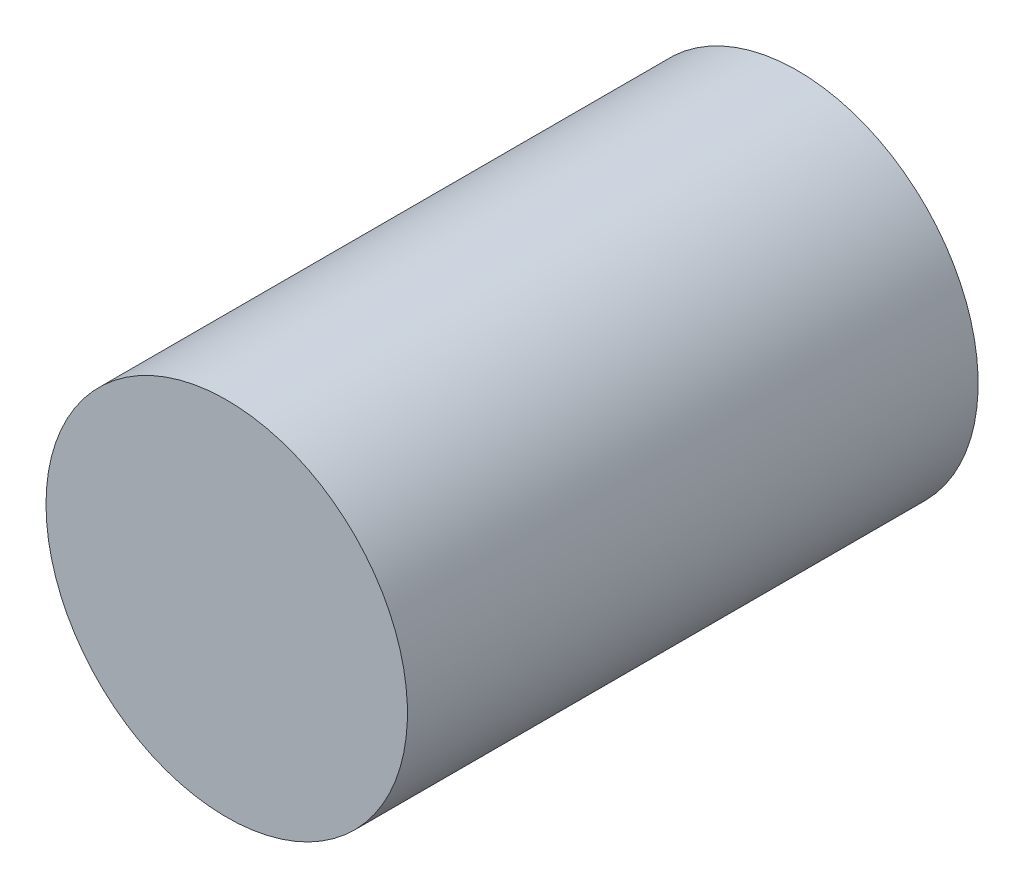
from build123d import *

# Parameters (mm, degrees)
SKETCH1_R           = 12.065
BOSS_EXTRUDE1_DEPTH = 38.1


with BuildPart() as part:
    # Sketch1 → Boss-Extrude1 (new body)
    with BuildSketch(Plane.XY):
        with Locations(Location((-12.431243965, 18.188426388, 0), (0, 0, 180))):
            Circle(SKETCH1_R)
    extrude(amount=BOSS_EXTRUDE1_DEPTH)


solid = part.part
